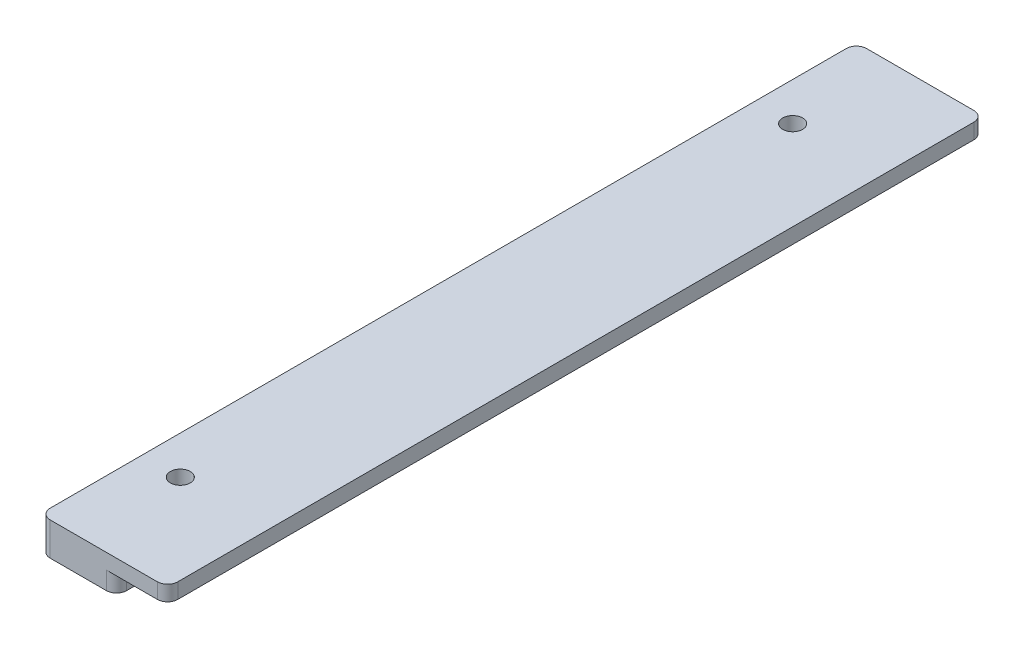
from build123d import *

# Parameters (mm, degrees)
EXTRUDE_1_DEPTH     = 160
CUT_EXTRUDE_1_REACH = 164.072
SKETCH_2_R          = 1.95
FILLET_1_R          = 2


with BuildPart() as part:
    # 草图1 → 凸台-拉伸1 (new body)
    with BuildSketch(Plane.XY):
        Polygon((0, 0), (0, 6.5), (25, 6.5), (25, 3.5), (15, 3.5), (15, 0), align=None)
    extrude(amount=EXTRUDE_1_DEPTH)

    # 草图2 → 切除-拉伸1 (cut, up to next)
    with BuildSketch(Plane.XZ, mode=Mode.PRIVATE) as cut_extrude_1_sk1:
        with Locations(Location((7.5, 140, 0), (0, 0, 270))):
            Circle(SKETCH_2_R)
    cut_extrude_1_tool1 = extrude(cut_extrude_1_sk1.sketch, amount=-CUT_EXTRUDE_1_REACH, mode=Mode.PRIVATE) & part.part
    # 草图2 → 切除-拉伸1 (cut, up to next)
    with BuildSketch(Plane.XZ, mode=Mode.PRIVATE) as cut_extrude_1_sk2:
        with Locations(Location((7.5, 20, 0), (0, 0, 270))):
            Circle(SKETCH_2_R)
    cut_extrude_1_tool2 = extrude(cut_extrude_1_sk2.sketch, amount=-CUT_EXTRUDE_1_REACH, mode=Mode.PRIVATE) & part.part
    add(cut_extrude_1_tool1.solids().sort_by_distance((7.5, 0, 140))[0], mode=Mode.SUBTRACT)
    add(cut_extrude_1_tool2.solids().sort_by_distance((7.5, 0, 20))[0], mode=Mode.SUBTRACT)

    # 圆角1
    fillet_1_edges = [part.edges().sort_by_distance(p)[0] for p in [
        (25, 5, 160),
        (0, 3.25, 160),
        (0, 3.25, 0),
        (25, 5, 0),
        (15, 1.75, 0),
        (15, 1.75, 160),
    ]]
    fillet(fillet_1_edges, radius=FILLET_1_R)


solid = part.part
